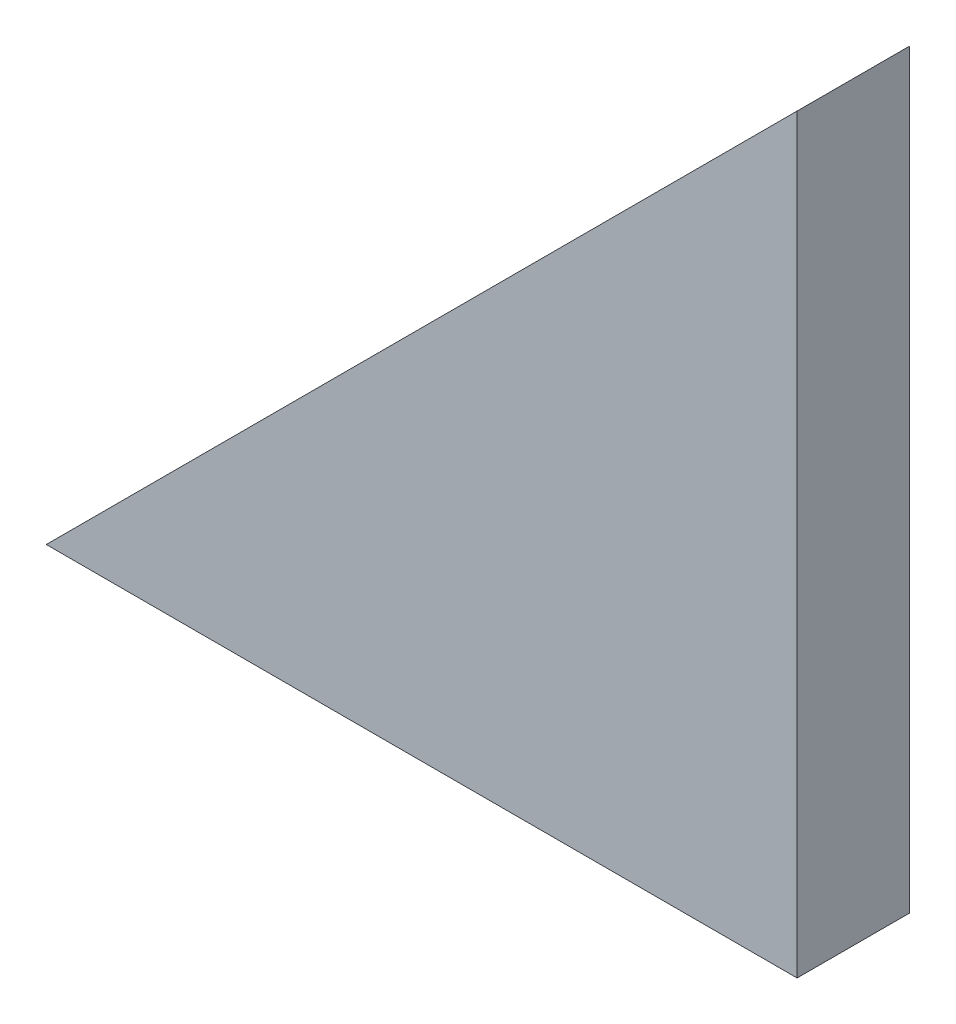
from build123d import *

# Parameters (mm, degrees)
BOSS_EXTRUDE1_DEPTH = 3


with BuildPart() as part:
    # Sketch1 → Boss-Extrude1 (new body)
    with BuildSketch(Plane.XY):
        Polygon((0, 0), (0, 20), (-20, 0), align=None)
    extrude(amount=BOSS_EXTRUDE1_DEPTH)


solid = part.part
